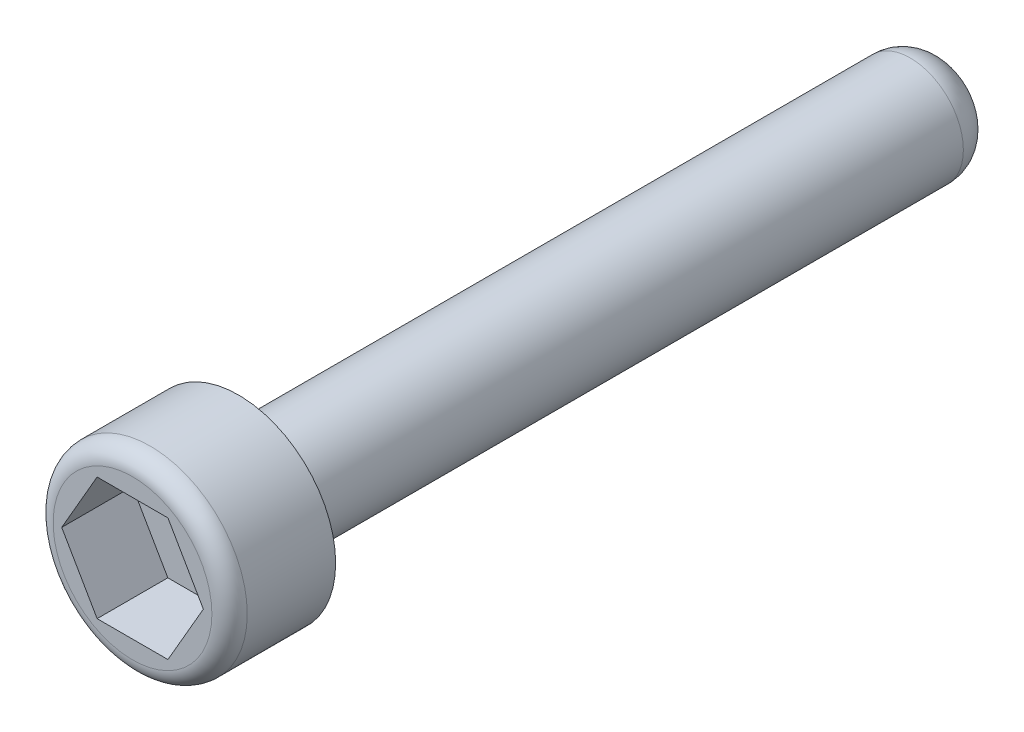
from build123d import *

# Parameters (mm, degrees)
SKETCH1_R          = 1.5
EXTRUDE1_DEPTH     = 20
SKETCH2_R          = 2.745016825
EXTRUDE2_DEPTH     = 3
CUT_EXTRUDE1_DEPTH = 2
FILLET1_R          = 0.5
FILLET2_R          = 1


with BuildPart() as part:
    # Sketch1 → Extrude1 (new body)
    with BuildSketch(Plane.XY):
        Circle(SKETCH1_R)
    extrude(amount=-EXTRUDE1_DEPTH)

    # Sketch2 → Extrude2 (add)
    with BuildSketch(Plane.XY):
        Circle(SKETCH2_R)
    extrude(amount=EXTRUDE2_DEPTH)

    # Sketch3 → Cut-Extrude1 (cut)
    with BuildSketch(Plane.XY.offset(3)):
        Polygon((-2.003123501, 0), (-1.00156175, -1.734755838), (1.00156175, -1.734755838), (2.003123501, 0), (1.00156175, 1.734755838), (-1.00156175, 1.734755838), align=None)
    extrude(amount=-CUT_EXTRUDE1_DEPTH, mode=Mode.SUBTRACT)

    # Fillet1
    fillet1_edges = [part.edges().sort_by_distance(p)[0] for p in [
        (-2.745016825, 0, 3),
    ]]
    fillet(fillet1_edges, radius=FILLET1_R)

    # Fillet2
    fillet2_edges = [part.edges().sort_by_distance(p)[0] for p in [
        (-1.5, 0, -20),
    ]]
    fillet(fillet2_edges, radius=FILLET2_R)


solid = part.part
